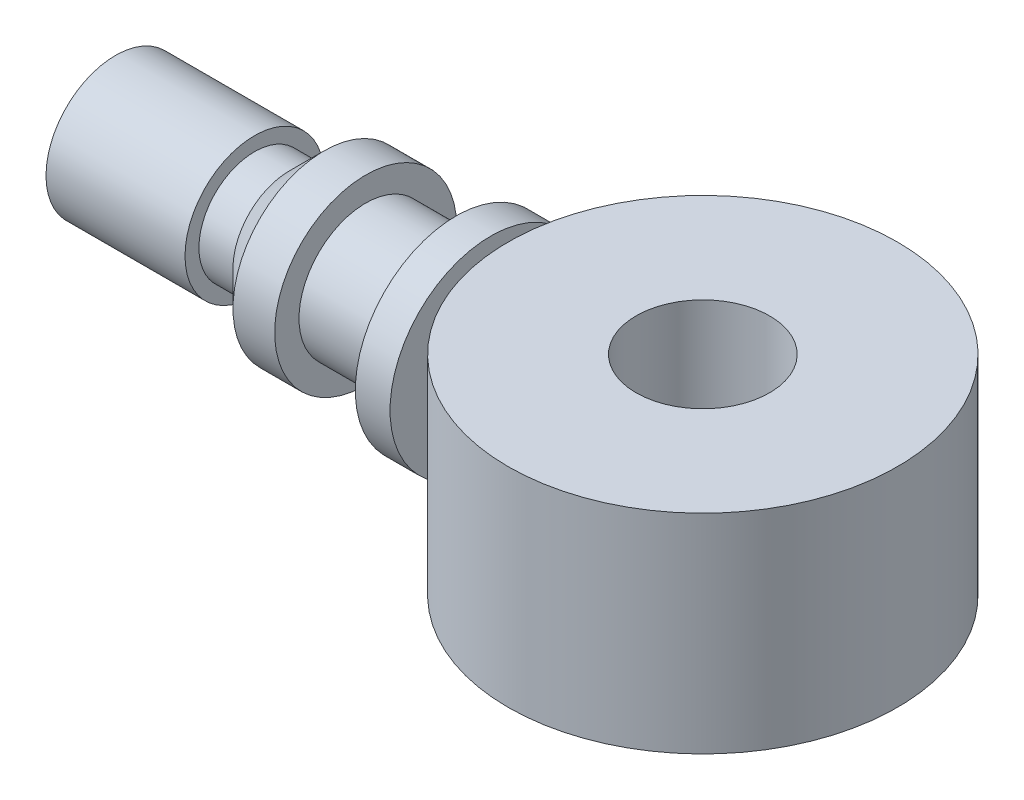
from build123d import *

# Parameters (mm, degrees)
SKETCH_2_R      = 7
SKETCH_2_R_2    = 2.4
EXTRUDE_1_DEPTH = 7.5
SKETCH_4_R      = 2
EXTRUDE_3_DEPTH = 1.25
SKETCH_5_R      = 2.5
SKETCH_5_R_2    = 2
EXTRUDE_4_DEPTH = 5
CHAMFER_1_SIZE  = 1.25


with BuildPart() as part:
    # 草图1 → 旋转1 (revolve)
    with BuildSketch(Plane(origin=(0, -42.25, 0), x_dir=(1, 0, 0), z_dir=(0, 1, 0)), mode=Mode.PRIVATE) as revolve_1_sk:
        Polygon((53.274875926, 15.125), (53.274875926, 17.125), (43.5, 17.125), (43.5, 13.85), (46.25, 13.85), (46.25, 14.725), (49.5, 14.725), (49.5, 13.5), (50.75, 13.5), (50.75, 15.125), align=None)
    revolve(revolve_1_sk.sketch.rotate(Axis((58.375, -42.25, -17.125), (-1, 0, 0)), 180), axis=Axis((58.375, -42.25, -17.125), (-1, 0, 0)))

    # 草图2 → 凸台-拉伸1 (add)
    with BuildSketch(Plane(origin=(0, -46, 0), x_dir=(1, 0, 0), z_dir=(0, 1, 0))):
        with Locations(Location((58.375, 17.125, 0), (0, 0, 270))):
            Circle(SKETCH_2_R)
        with Locations(Location((58.375, 17.125, 0), (0, 0, 270))):
            Circle(SKETCH_2_R_2, mode=Mode.SUBTRACT)
    extrude(amount=EXTRUDE_1_DEPTH)

    # 草图4 → 凸台-拉伸3 (add)
    with BuildSketch(Plane.ZY.offset(-43.5)):
        with Locations(Location((-17.125, -42.25, 0), (0, 0, 180))):
            Circle(SKETCH_4_R)
    extrude(amount=EXTRUDE_3_DEPTH)

    # 草图5 → 凸台-拉伸4 (add)
    # profile 1 of 2: a face of its own
    with BuildSketch(Plane.ZY.offset(-42.25)):
        with Locations((-17.125, -42.25)):
            Circle(SKETCH_5_R)
        with Locations(Location((-17.125, -42.25, 0), (0, 0, 180))):
            Circle(SKETCH_5_R_2, mode=Mode.SUBTRACT)
    # profile 2 of 2: a face of its own
    with BuildSketch(Plane.ZY.offset(-42.25)):
        with Locations(Location((-17.125, -42.25, 0), (0, 0, 180))):
            Circle(SKETCH_5_R_2)
    extrude(amount=EXTRUDE_4_DEPTH)

    # 倒角1
    chamfer_1_edges = [part.edges().sort_by_distance(p)[0] for p in [
        (43.5, -42.25, -13.85),
    ]]
    chamfer(chamfer_1_edges, length=CHAMFER_1_SIZE)


solid = part.part
